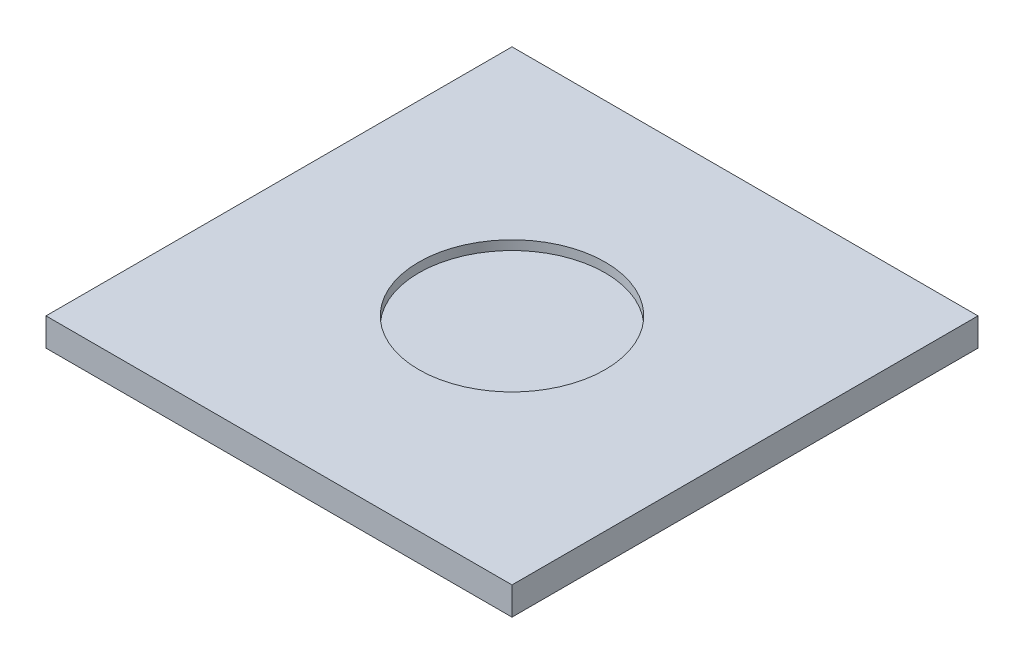
from build123d import *

# Parameters (mm, degrees)
SKETCH1_W           = 250
SKETCH1_H           = 250
BOSS_EXTRUDE1_DEPTH = 15
SKETCH2_R           = 50
CUT_EXTRUDE1_DEPTH  = 5


with BuildPart() as part:
    # Sketch1 → Boss-Extrude1 (new body)
    with BuildSketch(Plane(origin=(0, 0, 0), x_dir=(1, 0, 0), z_dir=(0, 1, 0))):
        Rectangle(SKETCH1_W, SKETCH1_H)
    extrude(amount=BOSS_EXTRUDE1_DEPTH)

    # Sketch2 → Cut-Extrude1 (cut)
    with BuildSketch(Plane(origin=(0, 15, 0), x_dir=(1, 0, 0), z_dir=(0, 1, 0))):
        with Locations(Location((0, 0, 0), (0, 0, 270))):
            Circle(SKETCH2_R)
    extrude(amount=-CUT_EXTRUDE1_DEPTH, mode=Mode.SUBTRACT)


solid = part.part
